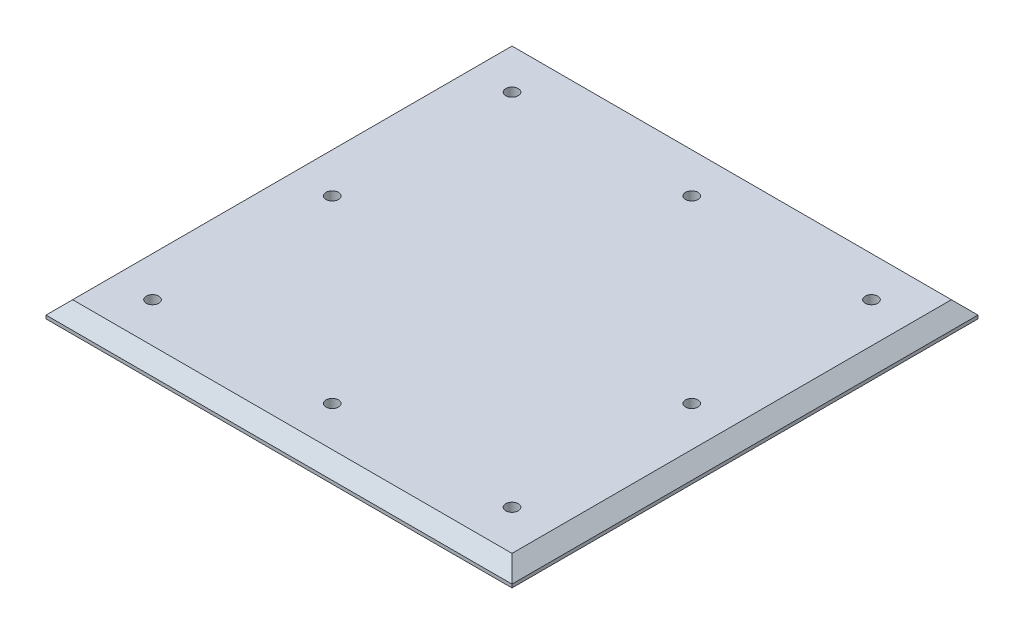
from build123d import *

# Parameters (mm, degrees)
SKETCH1_W           = 177.8
SKETCH1_H           = 177.8
SKETCH1_R           = 2.38125
BOSS_EXTRUDE1_DEPTH = 6.35
CHAMFER1_SIZE       = 5.08


with BuildPart() as part:
    # Sketch1 → Boss-Extrude1 (new body)
    with BuildSketch(Plane(origin=(0, 0, 0), x_dir=(1, 0, 0), z_dir=(0, 1, 0))):
        with Locations((88.9, 88.9)):
            Rectangle(SKETCH1_W, SKETCH1_H)
        with Locations(Location((20.32, 157.48, 0), (0, 0, 270))):
            Circle(SKETCH1_R, mode=Mode.SUBTRACT)
        with Locations(Location((88.9, 157.48, 0), (0, 0, 270))):
            Circle(SKETCH1_R, mode=Mode.SUBTRACT)
        with Locations(Location((157.48, 157.48, 0), (0, 0, 270))):
            Circle(SKETCH1_R, mode=Mode.SUBTRACT)
        with Locations(Location((20.32, 88.9, 0), (0, 0, 270))):
            Circle(SKETCH1_R, mode=Mode.SUBTRACT)
        with Locations(Location((20.32, 20.32, 0), (0, 0, 270))):
            Circle(SKETCH1_R, mode=Mode.SUBTRACT)
        with Locations(Location((88.9, 20.32, 0), (0, 0, 270))):
            Circle(SKETCH1_R, mode=Mode.SUBTRACT)
        with Locations(Location((157.48, 88.9, 0), (0, 0, 270))):
            Circle(SKETCH1_R, mode=Mode.SUBTRACT)
        with Locations(Location((157.48, 20.32, 0), (0, 0, 270))):
            Circle(SKETCH1_R, mode=Mode.SUBTRACT)
    extrude(amount=BOSS_EXTRUDE1_DEPTH)

    # Chamfer1
    chamfer1_edges = [part.edges().sort_by_distance(p)[0] for p in [
        (177.8, 6.35, -88.9),
        (88.9, 6.35, -177.8),
        (0, 6.35, -88.9),
        (88.9, 6.35, 0),
    ]]
    chamfer(chamfer1_edges, length=CHAMFER1_SIZE)


solid = part.part
